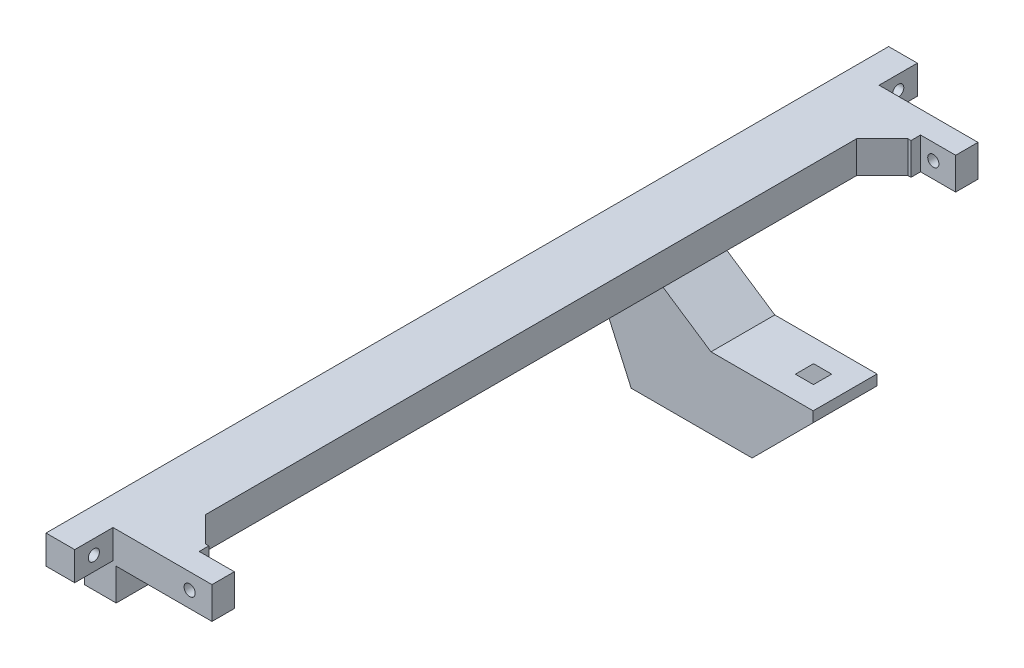
from build123d import *

# Parameters (mm, degrees)
BOSS_EXTRUDE1_DEPTH = 240
BOSS_EXTRUDE3_DEPTH = 10
SKETCH5_R           = 1.75
CUT_EXTRUDE1_DEPTH  = 243.69322199
SKETCH6_W           = 7
SKETCH6_H           = 12
CUT_EXTRUDE2_DEPTH  = 11
SKETCH7_W           = 20
SKETCH7_H           = 22.38
BOSS_EXTRUDE4_DEPTH = 57.02
BOSS_EXTRUDE5_DEPTH = 20
CUT_EXTRUDE3_DEPTH  = 20
SKETCH14_W          = 9
SKETCH14_H          = 9
BOSS_EXTRUDE6_DEPTH = 12
SKETCH15_W          = 9
SKETCH15_H          = 9
BOSS_EXTRUDE7_DEPTH = 12
SKETCH18_R          = 1.75
CUT_EXTRUDE10_DEPTH = 9
SKETCH19_R          = 3
CUT_EXTRUDE11_DEPTH = 3.1
SKETCH20_R          = 1.75
CUT_EXTRUDE12_DEPTH = 10
CUT_EXTRUDE13_DEPTH = 2.1
SKETCH22_R          = 1.75
CUT_EXTRUDE14_DEPTH = 15
SKETCH24_W          = 4
SKETCH24_H          = 5.7
CUT_EXTRUDE15_DEPTH = 260.337896961


with BuildPart() as part:
    # Sketch1 → Boss-Extrude1 (new body)
    with BuildSketch(Plane.XY):
        Polygon((-10, 0), (0, 0), (0, 10), (10, 10), (10, 20), (-10, 20), align=None)
    extrude(amount=BOSS_EXTRUDE1_DEPTH)

    # Sketch4 → Boss-Extrude3 (add)
    with BuildSketch(Plane(origin=(0, 20, 0), x_dir=(1, 0, 0), z_dir=(0, 1, 0))):
        Polygon((10, 0), (30, 0), (30, -10), (18, -10), (10, -18), align=None)
    boss_extrude3 = extrude(amount=-BOSS_EXTRUDE3_DEPTH)

    # Sketch5 → Cut-Extrude1 (cut, through all)
    with BuildSketch(Plane(origin=(0, 0, 0), x_dir=(-1, 0, 0), z_dir=(0, 0, -1))):
        with Locations((-23, 15)):
            Circle(SKETCH5_R)
    cut_extrude1 = extrude(amount=-CUT_EXTRUDE1_DEPTH, mode=Mode.SUBTRACT)

    # Sketch6 → Cut-Extrude2 (cut)
    with BuildSketch(Plane(origin=(30, 0, 0), x_dir=(0, 0, -1), z_dir=(1, 0, 0))):
        with Locations((-10.5, 15)):
            Rectangle(SKETCH6_W, SKETCH6_H)
    cut_extrude2 = extrude(amount=-CUT_EXTRUDE2_DEPTH, mode=Mode.SUBTRACT)

    # Mirror1: Boss-Extrude3, Cut-Extrude1, Cut-Extrude2 across plane
    add(boss_extrude3.mirror(Plane(origin=(0, 0, 120), x_dir=(1, 0, 0), z_dir=(0, 0, -1))))
    add(cut_extrude1.mirror(Plane(origin=(0, 0, 120), x_dir=(1, 0, 0), z_dir=(0, 0, -1))), mode=Mode.SUBTRACT)
    add(cut_extrude2.mirror(Plane(origin=(0, 0, 120), x_dir=(1, 0, 0), z_dir=(0, 0, -1))), mode=Mode.SUBTRACT)



with BuildPart() as body_2:
    # Sketch7 → Boss-Extrude4 (new body)
    with BuildSketch(Plane(origin=(0, 0, 0), x_dir=(0, 0, -1), z_dir=(1, 0, 0))):
        with Locations((-68.66, -11.19)):
            Rectangle(SKETCH7_W, SKETCH7_H)
    extrude(amount=BOSS_EXTRUDE4_DEPTH)


with BuildPart() as part_1:
    add(part.part)

    add(body_2.part)  # Boss-Extrude5 merges body 2
    # Sketch9 → Boss-Extrude5 (add)
    with BuildSketch(Plane(origin=(0, 0, 58.66), x_dir=(-1, 0, 0), z_dir=(0, 0, -1))):
        Polygon((-10, 10), (10, 10), (10, 0), (0, -22.38), (-25, -22.38), (-25, 0), align=None)
    extrude(amount=-BOSS_EXTRUDE5_DEPTH)

    # Sketch10 → Cut-Extrude3 (cut)
    with BuildSketch(Plane(origin=(0, 0, 58.66), x_dir=(-1, 0, 0), z_dir=(0, 0, -1))):
        Polygon((-31.667249158, -28.601477466), (-43.135001652, -40.069229961), (-74.531570141, -8.672661471), (-63.063817647, 2.795091023), align=None)
    extrude(amount=-CUT_EXTRUDE3_DEPTH, mode=Mode.SUBTRACT)

    # Sketch14 → Boss-Extrude6 (add)
    with BuildSketch(Plane(origin=(0, 0, 0), x_dir=(-1, 0, 0), z_dir=(0, 0, -1))):
        with Locations((5.5, 15.5)):
            Rectangle(SKETCH14_W, SKETCH14_H)
    extrude(amount=BOSS_EXTRUDE6_DEPTH)

    # Sketch15 → Boss-Extrude7 (add)
    with BuildSketch(Plane.XY.offset(240)):
        with Locations((-5.5, 15.5)):
            Rectangle(SKETCH15_W, SKETCH15_H)
    extrude(amount=BOSS_EXTRUDE7_DEPTH)

    # Sketch18 → Cut-Extrude10 (cut)
    with BuildSketch(Plane.ZY.offset(10)):
        with Locations(Location((-6, 15.5, 0), (0, 0, 270))):
            Circle(SKETCH18_R)
        with Locations(Location((246, 15.5, 0), (0, 0, 270))):
            Circle(SKETCH18_R)
    extrude(amount=-CUT_EXTRUDE10_DEPTH, mode=Mode.SUBTRACT)

    # Sketch19 → Cut-Extrude11 (cut)
    with BuildSketch(Plane.ZY.offset(10)):
        with Locations(Location((-6, 15.5, 0), (0, 0, 270))):
            Circle(SKETCH19_R)
        with Locations(Location((246, 15.5, 0), (0, 0, 270))):
            Circle(SKETCH19_R)
    extrude(amount=-CUT_EXTRUDE11_DEPTH, mode=Mode.SUBTRACT)

    # Sketch20 → Cut-Extrude12 (cut)
    with BuildSketch(Plane.ZY.offset(10)):
        with Locations(Location((140, 5, 0), (0, 0, 270))):
            Circle(SKETCH20_R)
    extrude(amount=-CUT_EXTRUDE12_DEPTH, mode=Mode.SUBTRACT)

    # Sketch21 → Cut-Extrude13 (cut)
    with BuildSketch(Plane.ZY.offset(10)):
        Polygon((141.645448267, 2.15), (143.290896534, 5), (141.645448267, 7.85), (138.354551733, 7.85), (136.709103466, 5), (138.354551733, 2.15), align=None)
    extrude(amount=-CUT_EXTRUDE13_DEPTH, mode=Mode.SUBTRACT)

    # Sketch22 → Cut-Extrude14 (cut)
    with BuildSketch(Plane(origin=(30.134363312, -30.134363312, 0), x_dir=(0, 0, -1), z_dir=(0.7071067811865474, -0.7071067811865477, 0))):
        with Locations(Location((-68.66, 24.452032037, 0), (0, 0, 90))):
            Circle(SKETCH22_R)
    extrude(amount=-CUT_EXTRUDE14_DEPTH, mode=Mode.SUBTRACT)

    # Sketch24 → Cut-Extrude15 (cut, through all)
    with BuildSketch(Plane(origin=(0, 0, 0), x_dir=(0.7071067811865477, -0.7071067811865475, 0), z_dir=(0.7071067811865475, 0.7071067811865477, 0))):
        with Locations((33.319228663, -68.66)):
            Rectangle(SKETCH24_W, SKETCH24_H)
    extrude(amount=CUT_EXTRUDE15_DEPTH, mode=Mode.SUBTRACT)


solid = part_1.part
